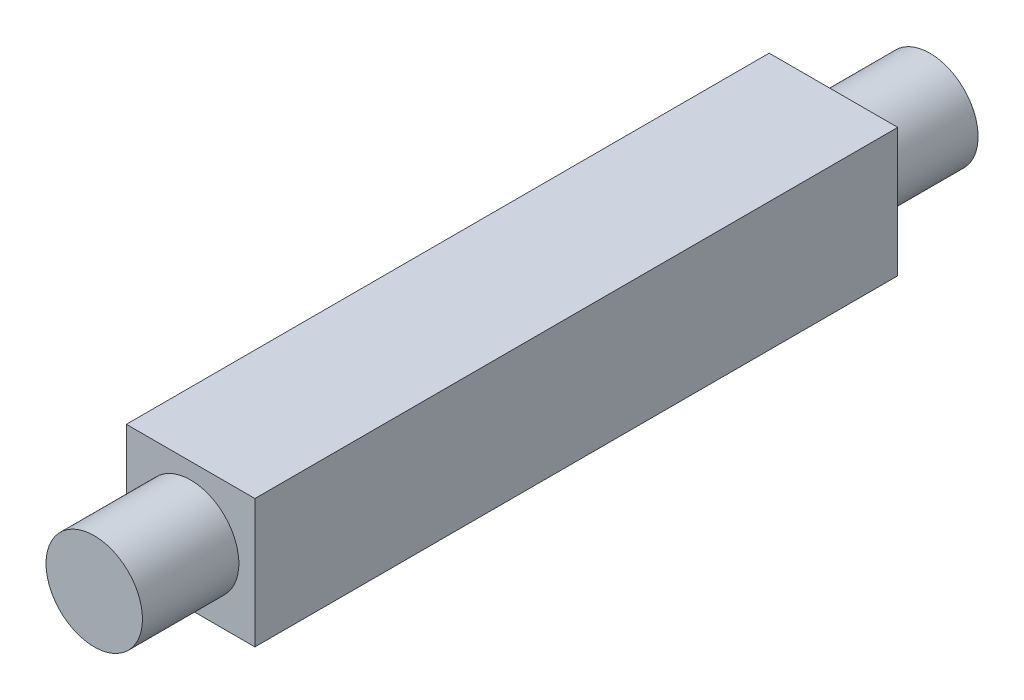
from build123d import *

# Parameters (mm, degrees)
CROQUIS1_W              = 4
CROQUIS1_H              = 4
SALIENTE_EXTRUIR1_DEPTH = 20
CROQUIS2_R              = 1.5
SALIENTE_EXTRUIR2_DEPTH = 3


with BuildPart() as part:
    # Croquis1 → Saliente-Extruir1 (new body)
    with BuildSketch(Plane.XY):
        Rectangle(CROQUIS1_W, CROQUIS1_H)
    extrude(amount=SALIENTE_EXTRUIR1_DEPTH)

    # Croquis2 → Saliente-Extruir2 (add)
    with BuildSketch(Plane(origin=(0, 0, 0), x_dir=(-1, 0, 0), z_dir=(0, 0, -1))):
        Circle(CROQUIS2_R)
    saliente_extruir2 = extrude(amount=SALIENTE_EXTRUIR2_DEPTH)

    # Simetría1: Saliente-Extruir2 across plane
    add(saliente_extruir2.mirror(Plane.XY.offset(10)))


solid = part.part
